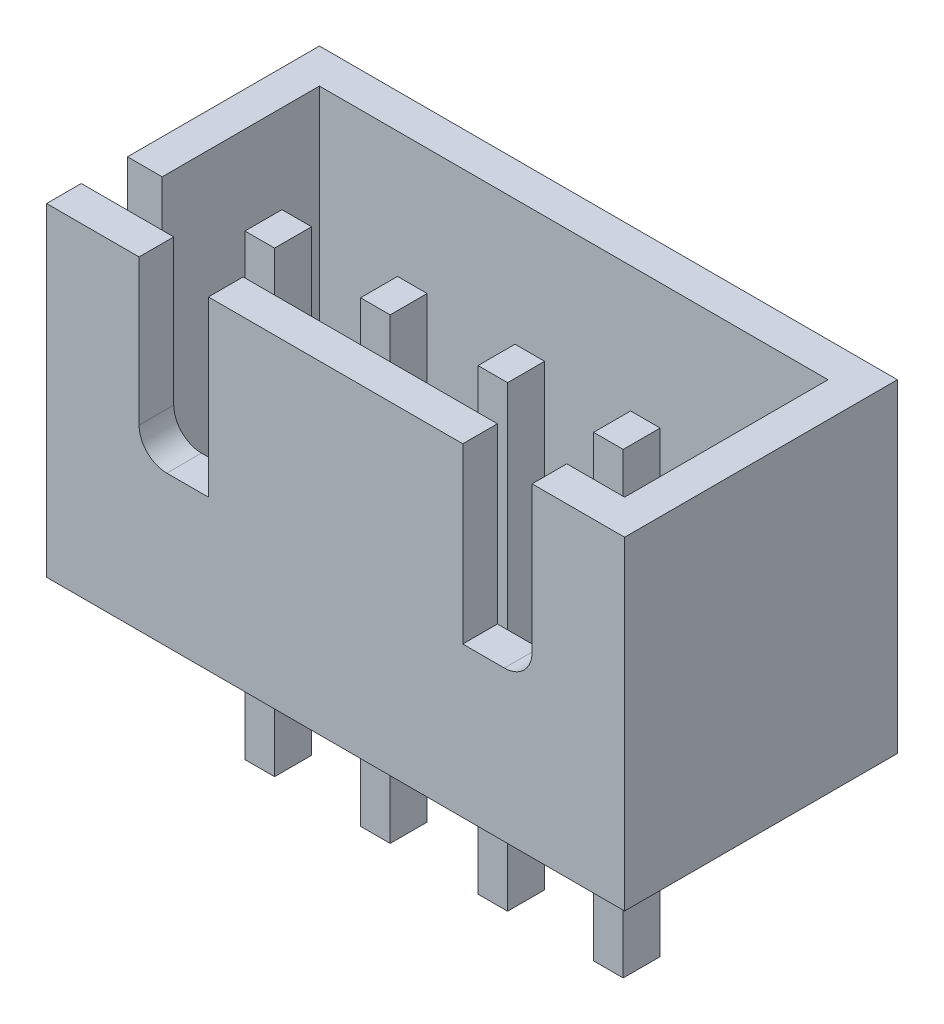
from build123d import *

# Parameters (mm, degrees)
CROQUIS1_W                   = 12.5
CROQUIS1_H                   = 5.9
CROQUIS1_W_2                 = 0.64
CROQUIS1_H_2                 = 0.8
SALIENTE_EXTRUIR1_DEPTH      = 1
CROQUIS2_W                   = 12.5
CROQUIS2_H                   = 5.9
CROQUIS2_W_2                 = 11
CROQUIS2_H_2                 = 4.4
SALIENTE_EXTRUIR2_DEPTH      = 6
CORTAR_EXTRUIR1_DEPTH        = 9
CORTAR_EXTRUIR2_DEPTH        = 2
SALIENTE_EXTRUIR3_DEPTH      = 6.5
SALIENTE_EXTRUIR3_DEPTH_BACK = 3.4
CROQUIS5_W                   = 0.64
CROQUIS5_H                   = 0.8


with BuildPart() as part:
    # Croquis1 → Saliente-Extruir1 (new body)
    with BuildSketch(Plane(origin=(0, 0, 0), x_dir=(1, 0, 0), z_dir=(0, 1, 0))):
        with Locations((3.77, 0.42)):
            Rectangle(CROQUIS1_W, CROQUIS1_H)
        Rectangle(CROQUIS1_W_2, CROQUIS1_H_2, mode=Mode.SUBTRACT)
        with Locations((7.54, 0)):
            Rectangle(CROQUIS1_W_2, CROQUIS1_H_2, mode=Mode.SUBTRACT)
        with Locations((5.04, 0)):
            Rectangle(CROQUIS1_W_2, CROQUIS1_H_2, mode=Mode.SUBTRACT)
        with Locations((2.5, 0)):
            Rectangle(CROQUIS1_W_2, CROQUIS1_H_2, mode=Mode.SUBTRACT)
    extrude(amount=SALIENTE_EXTRUIR1_DEPTH)

    # Croquis2 → Saliente-Extruir2 (add)
    with BuildSketch(Plane(origin=(0, 1, 0), x_dir=(1, 0, 0), z_dir=(0, 1, 0))):
        with Locations((3.77, 0.42)):
            Rectangle(CROQUIS2_W, CROQUIS2_H)
        with Locations((3.77, 0.42)):
            Rectangle(CROQUIS2_W_2, CROQUIS2_H_2, mode=Mode.SUBTRACT)
    extrude(amount=SALIENTE_EXTRUIR2_DEPTH)

    # Croquis3 → Cortar-Extruir1 (cut)
    with BuildSketch(Plane.ZY.offset(2.48)):
        with BuildLine():
            Line((1.78, 7), (1.78, 4.35))
            ThreePointArc((1.78, 4.35), (1.604264069, 3.925735931), (1.18, 3.75))
            Line((1.18, 3.75), (0.78, 3.75))
            Line((0.78, 3.75), (0.78, 7))
            Line((0.78, 7), (1.78, 7))
        make_face()
    extrude(amount=-CORTAR_EXTRUIR1_DEPTH, mode=Mode.SUBTRACT)

    # Croquis4 → Cortar-Extruir2 (cut)
    with BuildSketch(Plane.XY.offset(2.53)):
        with BuildLine():
            Line((-0.48, 7), (-0.48, 3.85))
            ThreePointArc((-0.48, 3.85), (-0.304264069, 3.425735931), (0.12, 3.25))
            Line((0.12, 3.25), (1.02, 3.25))
            Line((1.02, 3.25), (1.02, 7))
            Line((1.02, 7), (-0.48, 7))
        make_face()
        with BuildLine():
            Line((8.02, 7), (6.52, 7))
            Line((6.52, 7), (6.52, 3.25))
            Line((6.52, 3.25), (7.42, 3.25))
            ThreePointArc((7.42, 3.25), (7.844264069, 3.425735931), (8.02, 3.85))
            Line((8.02, 3.85), (8.02, 7))
        make_face()
    extrude(amount=-CORTAR_EXTRUIR2_DEPTH, mode=Mode.SUBTRACT)

    # Croquis5 → Saliente-Extruir3 (add, two sides: drawn at the far end of the back side and taken through both)
    with BuildSketch(Plane(origin=(0, 0, 0), x_dir=(1, 0, 0), z_dir=(0, 1, 0)).offset(-SALIENTE_EXTRUIR3_DEPTH_BACK)):
        with Locations((7.54, 0)):
            Rectangle(CROQUIS5_W, CROQUIS5_H)
        Rectangle(CROQUIS5_W, CROQUIS5_H)
        with Locations((2.5, 0)):
            Rectangle(CROQUIS5_W, CROQUIS5_H)
        with Locations((5.04, 0)):
            Rectangle(CROQUIS5_W, CROQUIS5_H)
    extrude(amount=SALIENTE_EXTRUIR3_DEPTH + SALIENTE_EXTRUIR3_DEPTH_BACK)


solid = part.part
